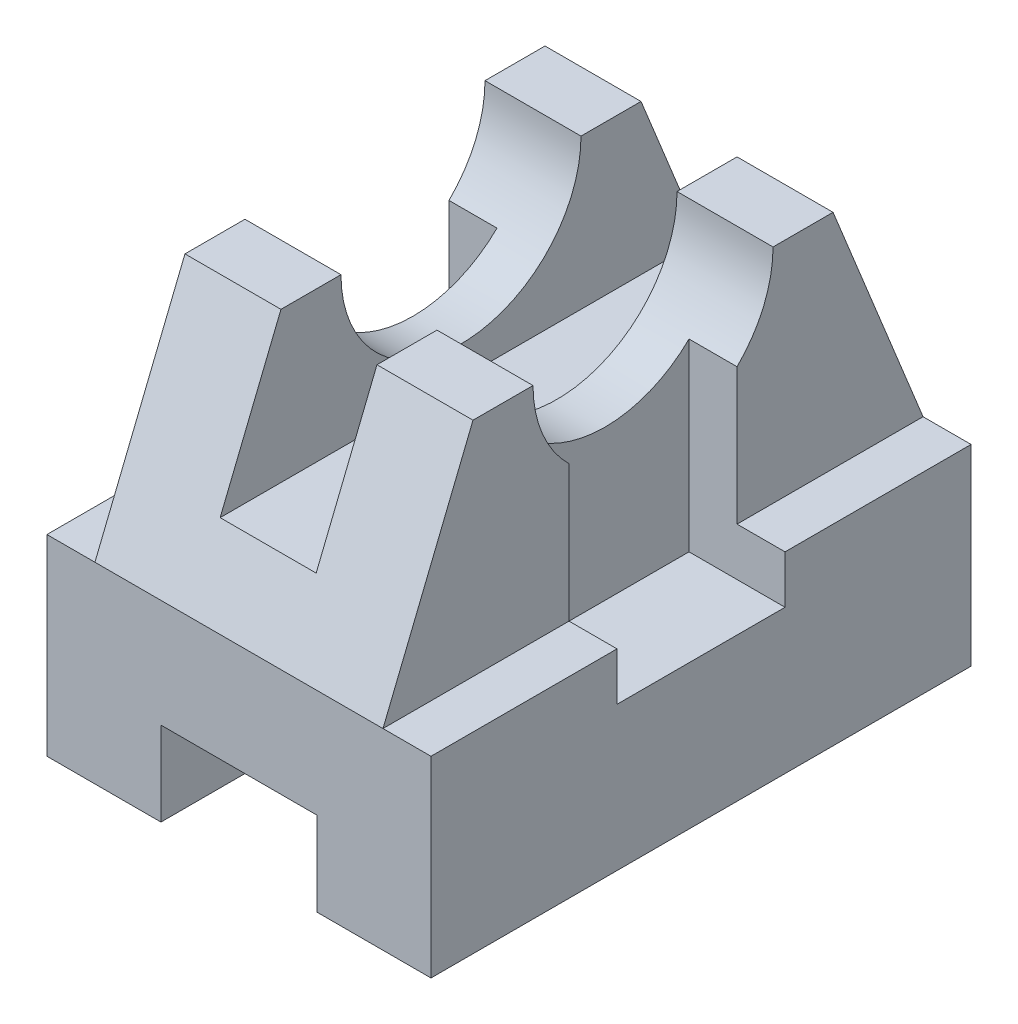
from build123d import *

# Parameters (mm, degrees)
BOSS_EXTRUDE1_DEPTH     = 45
BOSS_EXTRUDE2_DEPTH     = 24
CUT_EXTRUDE1_DEPTH      = 89.374204381
CUT_EXTRUDE1_DEPTH_BACK = 89.374204381
SKETCH3_W               = 16
SKETCH3_H               = 25
SKETCH4_R               = 20
CUT_EXTRUDE2_DEPTH      = 100.60923652
SKETCH5_W               = 16
SKETCH5_H               = 45
CUT_EXTRUDE3_DEPTH      = 14


with BuildPart() as part:
    # Sketch1 → Boss-Extrude1 (new, symmetric)
    with BuildSketch(Plane.XY):
        Polygon((-32, 0), (-13, 0), (-13, 14), (13, 14), (13, 0), (32, 0), (32, 32), (-32, 32), align=None)
    extrude(amount=BOSS_EXTRUDE1_DEPTH, both=True)

    # Sketch2 → Boss-Extrude2 (add, symmetric)
    with BuildSketch(Plane(origin=(0, 0, 0), x_dir=(0, 0, -1), z_dir=(1, 0, 0))):
        Polygon((-45, 32), (45, 32), (30, 69), (-30, 69), align=None)
    extrude(amount=BOSS_EXTRUDE2_DEPTH, both=True)

    # Sketch3 → Cut-Extrude1 (cut, two sides: drawn at the far end of the back side and taken through both)
    with BuildSketch(Plane.XY.offset(-CUT_EXTRUDE1_DEPTH_BACK)):
        with Locations((0, 56.5)):
            Rectangle(SKETCH3_W, SKETCH3_H)
    extrude(amount=CUT_EXTRUDE1_DEPTH + CUT_EXTRUDE1_DEPTH_BACK, mode=Mode.SUBTRACT)

    # Sketch4 → Cut-Extrude2 (cut, through all)
    with BuildSketch(Plane(origin=(24, 0, 0), x_dir=(0, 0, -1), z_dir=(1, 0, 0))):
        with Locations((0, 69)):
            Circle(SKETCH4_R)
    extrude(amount=-CUT_EXTRUDE2_DEPTH, mode=Mode.SUBTRACT)

    # Sketch5 → Cut-Extrude3 (cut, symmetric)
    with BuildSketch(Plane.XY):
        with Locations((-24, 46.5)):
            Rectangle(SKETCH5_W, SKETCH5_H)
        with Locations((24, 46.5)):
            Rectangle(SKETCH5_W, SKETCH5_H)
    extrude(amount=CUT_EXTRUDE3_DEPTH, both=True, mode=Mode.SUBTRACT)


solid = part.part
